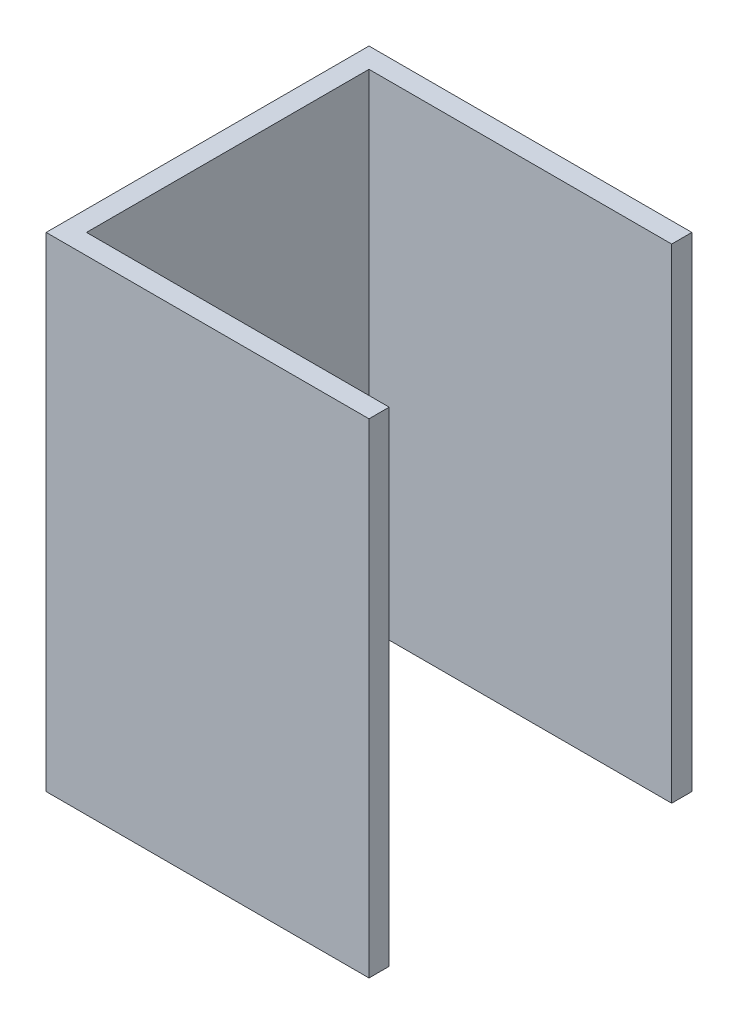
from build123d import *

# Parameters (mm, degrees)
BOSS_EXTRUDE1_DEPTH = 38.1


with BuildPart() as part:
    # Sketch1 → Boss-Extrude1 (new body)
    with BuildSketch(Plane(origin=(0, 0, 0), x_dir=(1, 0, 0), z_dir=(0, 1, 0))):
        Polygon((0, 0), (-25.4, 0), (-25.4, -25.4), (0, -25.4), (0, -23.8125), (-23.8125, -23.8125), (-23.8125, -1.5875), (0, -1.5875), align=None)
    extrude(amount=BOSS_EXTRUDE1_DEPTH)


solid = part.part
